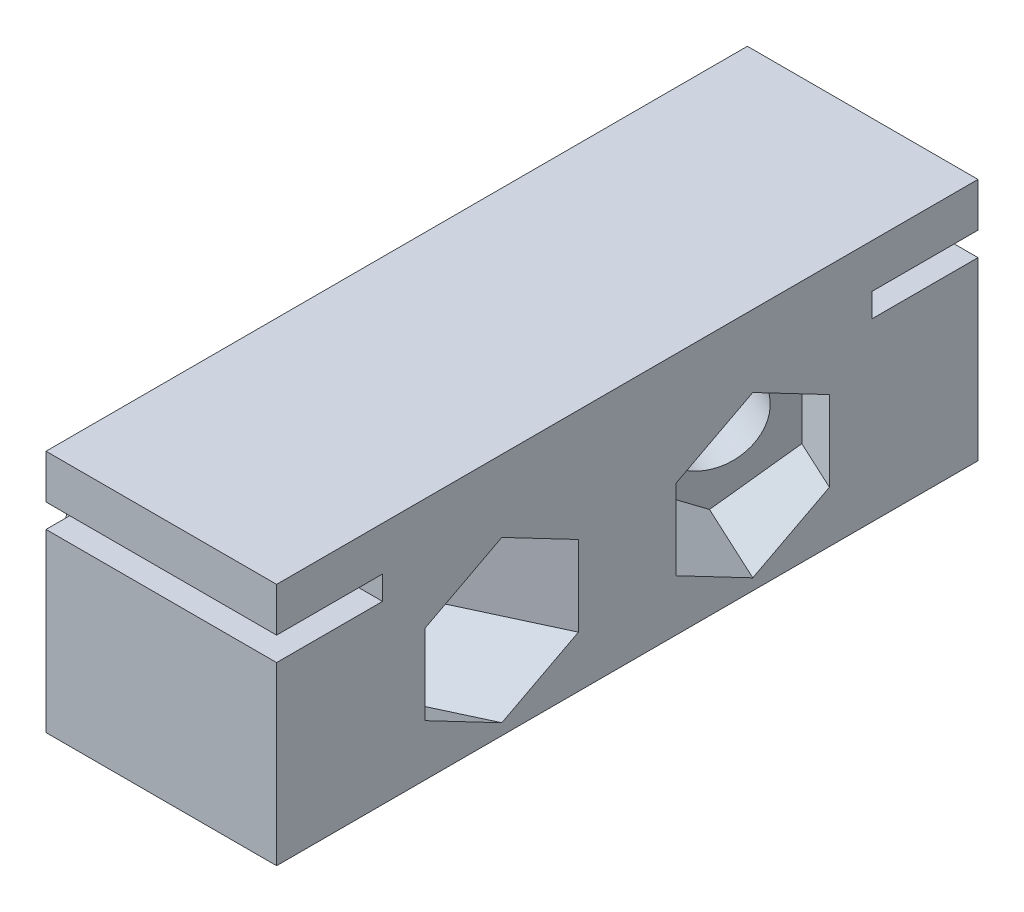
from build123d import *

# Parameters (mm, degrees)
REVOLVE1_ANGLE       = 70
BOSS_EXTRUDE1_START  = -17.5895
BOSS_EXTRUDE1_DEPTH  = 17.5895
BOSS_EXTRUDE2_DEPTH  = 3.175
BOSS_EXTRUDE3_DEPTH  = 12.7
CUT_SWEEP1_PROFILE_R = 3.302
CUT_EXTRUDE7_DEPTH   = 27.94
BOSS_EXTRUDE4_REACH  = 54.438
CUT_EXTRUDE8_DEPTH   = 1.7145
CUT_EXTRUDE9_DEPTH   = 54.83153704
BOSS_EXTRUDE5_REACH  = 52.224
SKETCH45_R           = 5
SKETCH45_R_2         = 3.302


with BuildPart() as part:
    # Sketch3 → Revolve1 (revolve, symmetric)
    with BuildSketch(Plane.XY) as revolve1_sk:
        Polygon((-44.1325, 4.03225), (-23.8125, 4.03225), (-23.8125, -13.55725), (-44.1325, -13.55725), (-44.1325, -0.85725), (-30.7975, -0.85725), (-30.7975, 0.85725), (-44.1325, 0.85725), align=None)
    revolve(axis=Axis((0, -1086.549659172, 0), (0, 1, 0)), revolution_arc=REVOLVE1_ANGLE / 2)
    revolve(revolve1_sk.sketch, axis=Axis((0, -1086.549659172, 0), (0, -1, 0)), revolution_arc=REVOLVE1_ANGLE / 2)

    # Sketch10 → Boss-Extrude1 (add)
    with BuildSketch(Plane(origin=(0, 4.03225, 0), x_dir=(1, 0, 0), z_dir=(0, 1, 0)).offset(BOSS_EXTRUDE1_START)):
        with BuildLine():
            Line((-19.506058055, 13.658288891), (-19.506058055, -13.658288891))
            ThreePointArc((-19.506058055, -13.658288891), (-23.8125, 0), (-19.506058055, 13.658288891))
        make_face()
    extrude(amount=BOSS_EXTRUDE1_DEPTH)

    # Sketch11 → Boss-Extrude2 (add)
    with BuildSketch(Plane(origin=(0, 4.03225, 0), x_dir=(1, 0, 0), z_dir=(0, 1, 0))):
        Polygon((-36.151227595, 25.313362077), (-19.506058055, 25.313362077), (-19.506058055, 13.658288891), align=None)
        Polygon((-36.151227595, -25.313362077), (-19.506058055, -25.313362077), (-19.506058055, -13.658288891), align=None)
    extrude(amount=-BOSS_EXTRUDE2_DEPTH)

    # Sketch12 → Boss-Extrude3 (add)
    with BuildSketch(Plane.XZ.offset(13.55725)):
        Polygon((-36.151227595, 25.313362077), (-19.506058055, 25.313362077), (-19.506058055, 13.658288891), align=None)
        Polygon((-36.151227595, -25.313362077), (-19.506058055, -13.658288891), (-19.506058055, -25.313362077), align=None)
    extrude(amount=-BOSS_EXTRUDE3_DEPTH)

    # Cut-Sweep1: sweep along a path in Sketch14
    with BuildLine(Plane(origin=(0, -6.95325, 0), x_dir=(-1, 0, 0), z_dir=(0, -1, 0))) as cut_sweep1_path:
        Line((9.675589129, 4.493239256), (40.02699074, 18.588102876))
    # Cut-Sweep1 profile (on start of the path) → Cut-Sweep1 (sweep, cut)
    with BuildSketch(Plane(origin=(-9.675589129, -6.95325, -4.493239256), x_dir=(0.421188531725906, 0, -0.9069731091617742), z_dir=(-0.9069731091617742, -3.1111435997184875e-15, -0.421188531725906))):
        Circle(CUT_SWEEP1_PROFILE_R)
    cut_sweep1 = sweep(path=cut_sweep1_path.line, mode=Mode.SUBTRACT)

    # Mirror1: Cut-Sweep1 across plane
    add(cut_sweep1.mirror(Plane.XY), mode=Mode.SUBTRACT)

    # Sketch37 → Cut-Extrude7 (cut)
    with BuildSketch(Plane(origin=(0, 0, 0), x_dir=(-0.42118853172590587, -1.4445522614505264e-15, 0.9069731091617743), z_dir=(-0.9069731091617742, -3.103462646485123e-15, -0.4211885317259058))):
        Polygon((-5.0165, -4.056972375), (-5.0165, -9.849527625), (0, -12.745805251), (5.0165, -9.849527625), (5.0165, -4.056972375), (0, -1.160694749), align=None)
    cut_extrude7 = extrude(amount=CUT_EXTRUDE7_DEPTH, mode=Mode.SUBTRACT)

    # Mirror2: Cut-Extrude7 across plane
    add(cut_extrude7.mirror(Plane.XY), mode=Mode.SUBTRACT)

    # Sketch38 → Boss-Extrude4 (add, up to next)
    with BuildSketch(Plane(origin=(0, -0.85725, 0), x_dir=(1, 0, 0), z_dir=(0, 1, 0)), mode=Mode.PRIVATE) as boss_extrude4_sk1:
        Polygon((-25.227835084, 17.664720299), (-19.506058055, 17.664720299), (-19.506058055, 13.658288891), align=None)
    boss_extrude4_tool1 = extrude(boss_extrude4_sk1.sketch, amount=BOSS_EXTRUDE4_REACH, mode=Mode.PRIVATE) - part.part
    # Sketch38 → Boss-Extrude4 (add, up to next)
    with BuildSketch(Plane(origin=(0, -0.85725, 0), x_dir=(1, 0, 0), z_dir=(0, 1, 0)), mode=Mode.PRIVATE) as boss_extrude4_sk2:
        Polygon((-25.227835084, -17.664720299), (-19.506058055, -13.658288891), (-19.506058055, -17.664720299), align=None)
    boss_extrude4_tool2 = extrude(boss_extrude4_sk2.sketch, amount=BOSS_EXTRUDE4_REACH, mode=Mode.PRIVATE) - part.part
    add(boss_extrude4_tool1.solids().sort_by_distance((-21.413317, -0.85725, -16.329243))[0])
    add(boss_extrude4_tool2.solids().sort_by_distance((-21.413317, -0.85725, 16.329243))[0])

    # Sketch39 → Cut-Extrude8 (cut)
    with BuildSketch(Plane.XZ.offset(-0.85725)):
        with BuildLine():
            Line((-25.227835084, -17.664720299), (-25.227835084, 17.664720299))
            ThreePointArc((-25.227835084, 17.664720299), (-30.7975, 0), (-25.227835084, -17.664720299))
        make_face()
    extrude(amount=CUT_EXTRUDE8_DEPTH, mode=Mode.SUBTRACT)

    # Sketch44 → Cut-Extrude9 (cut, through all)
    with BuildSketch(Plane.XZ.offset(13.55725)):
        with BuildLine():
            Line((-36.151227595, 25.313362077), (-36.151227595, -25.313362077))
            ThreePointArc((-36.151227595, -25.313362077), (-44.1325, 0), (-36.151227595, 25.313362077))
        make_face()
    extrude(amount=-CUT_EXTRUDE9_DEPTH, mode=Mode.SUBTRACT)

    # Boss-Extrude5: up to this plane
    boss_extrude5_end = Plane(origin=(-36.151227595, 4.03225, 25.313362077), z_dir=(1, 0, 0))
    # Sketch45 → Boss-Extrude5 (add, up to the surface)
    with BuildSketch(Plane(origin=(-39.906816803, 0, -18.532295396), x_dir=(-0.42118853172590587, -1.4445522614505264e-15, 0.9069731091617743), z_dir=(-0.9069731091617742, -3.103462646485123e-15, -0.4211885317259058)), mode=Mode.PRIVATE) as boss_extrude5_sk1:
        with Locations((0, -6.95325)):
            Circle(SKETCH45_R)
        with Locations((0, -6.95325)):
            Circle(SKETCH45_R_2, mode=Mode.SUBTRACT)
    boss_extrude5_tool1 = split(extrude(boss_extrude5_sk1.sketch, amount=-BOSS_EXTRUDE5_REACH, mode=Mode.PRIVATE), bisect_by=boss_extrude5_end, keep=Keep.BOTH, mode=Mode.PRIVATE)
    boss_extrude5 = boss_extrude5_tool1.solids().sort_by_distance((-37.860439, -6.95325, -22.938896))[0]
    add(boss_extrude5)

    # Mirror3: Boss-Extrude5 across plane
    add(boss_extrude5.mirror(Plane.XY))


solid = part.part
